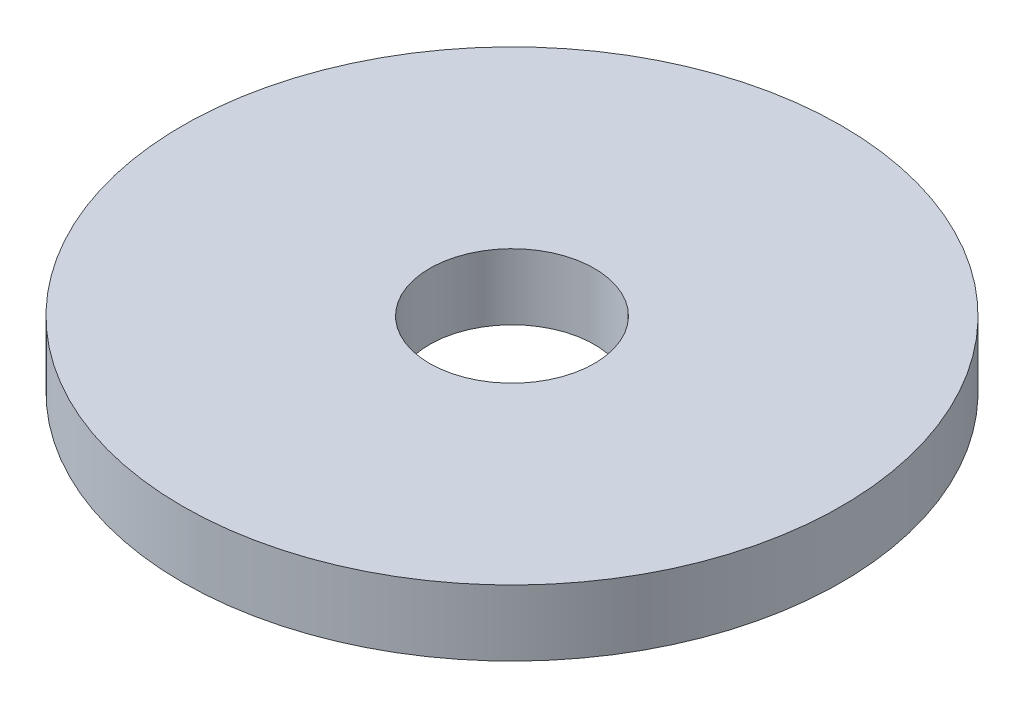
from build123d import *

# Parameters (mm, degrees)
SKETCH1_R           = 12.5
SKETCH1_R_2         = 2.125
BOSS_EXTRUDE1_DEPTH = 2
SKETCH2_R           = 2.5
CUT_EXTRUDE1_DEPTH  = 10
CUT_EXTRUDE2_START  = -10
SKETCH3_R           = 12.5
SKETCH3_R_2         = 10
CUT_EXTRUDE2_DEPTH  = 10


with BuildPart() as part:
    # Sketch1 → Boss-Extrude1 (new body)
    with BuildSketch(Plane(origin=(0, 0, 0), x_dir=(1, 0, 0), z_dir=(0, 1, 0))):
        with Locations(Location((0, 0, 0), (0, 0, 270))):
            Circle(SKETCH1_R)
        with Locations(Location((0, 0, 0), (0, 0, 270))):
            Circle(SKETCH1_R_2, mode=Mode.SUBTRACT)
    extrude(amount=BOSS_EXTRUDE1_DEPTH)

    # Sketch2 → Cut-Extrude1 (cut)
    with BuildSketch(Plane(origin=(0, 2, 0), x_dir=(1, 0, 0), z_dir=(0, 1, 0))):
        with Locations(Location((0, 0, 0), (0, 0, 270))):
            Circle(SKETCH2_R)
    extrude(amount=-CUT_EXTRUDE1_DEPTH, mode=Mode.SUBTRACT)

    # Sketch3 → Cut-Extrude2 (cut)
    with BuildSketch(Plane(origin=(0, 2, 0), x_dir=(1, 0, 0), z_dir=(0, 1, 0)).offset(CUT_EXTRUDE2_START)):
        Circle(SKETCH3_R)
        with Locations(Location((0, 0, 0), (0, 0, 270))):
            Circle(SKETCH3_R_2, mode=Mode.SUBTRACT)
    extrude(amount=CUT_EXTRUDE2_DEPTH, mode=Mode.SUBTRACT)


solid = part.part
